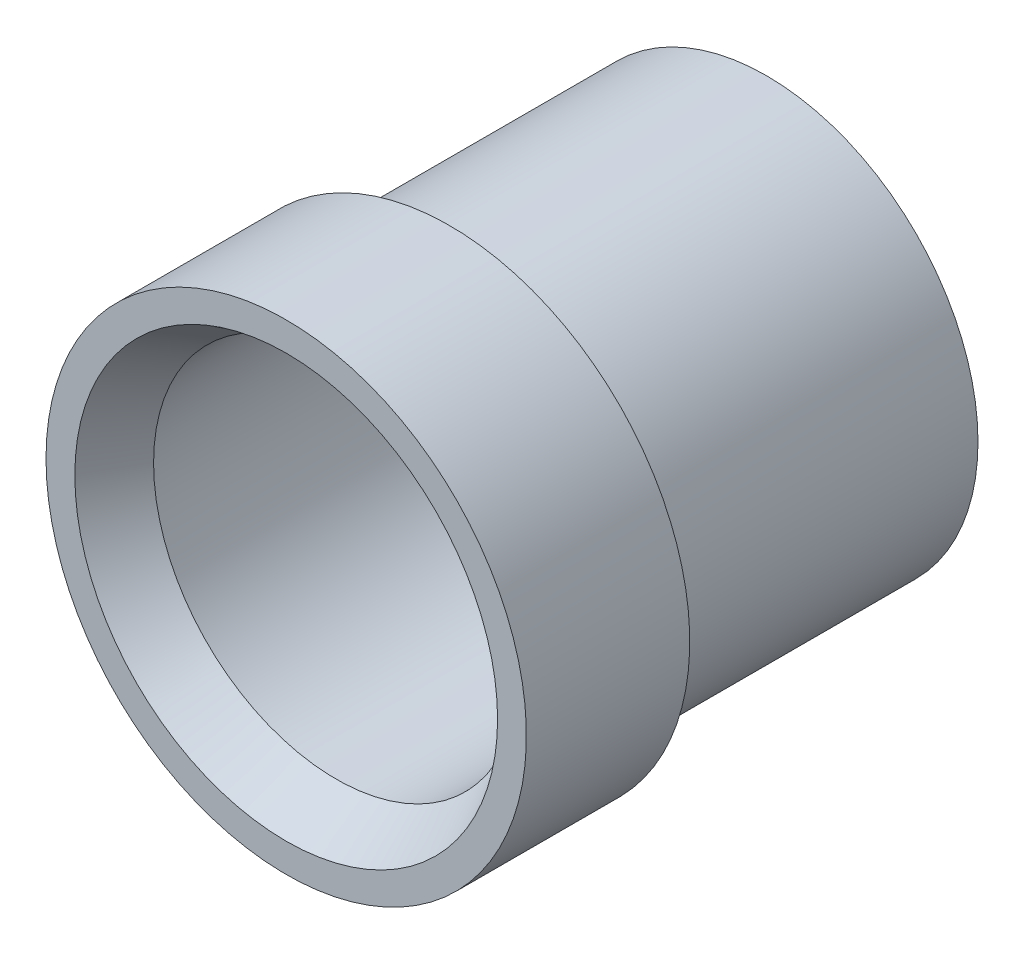
from build123d import *


with BuildPart() as part:
    # Sketch1 → Revolve1 (revolve)
    with BuildSketch(Plane(origin=(0, 0, 0), x_dir=(0, 0, -1), z_dir=(1, 0, 0)), mode=Mode.PRIVATE) as revolve1_sk:
        Polygon((-6.35, 5.588), (-5.030177285, 4.826), (6.35, 4.826), (6.35, 5.588), (-2.032, 5.588), (-2.032, 6.35), (-6.35, 6.35), align=None)
    revolve(revolve1_sk.sketch.rotate(Axis((0, 0, -6.35), (0, 0, 1)), 90), axis=Axis((0, 0, -6.35), (0, 0, 1)))


solid = part.part
